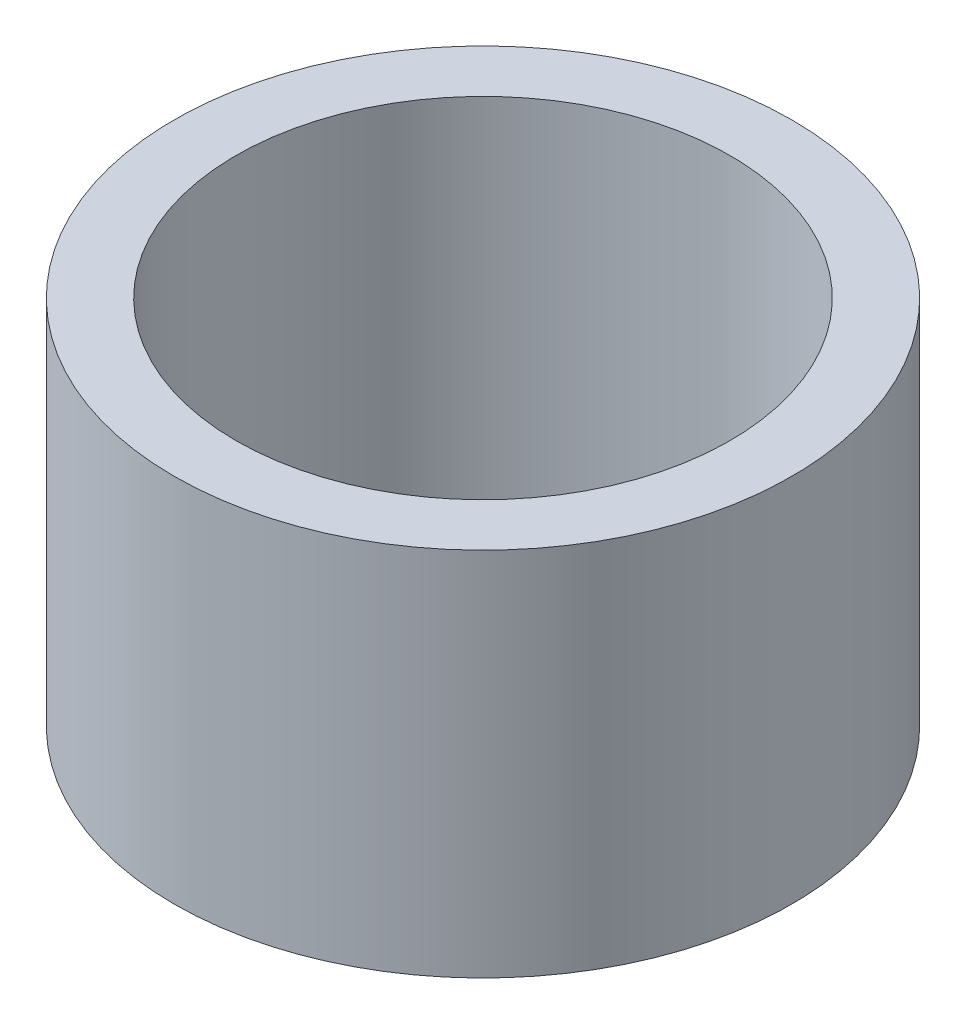
from build123d import *

# Parameters (mm, degrees)
SKETCH1_R           = 5
SKETCH1_R_2         = 4
BOSS_EXTRUDE1_DEPTH = 6


with BuildPart() as part:
    # Sketch1 → Boss-Extrude1 (new body)
    with BuildSketch(Plane(origin=(0, 0, 0), x_dir=(1, 0, 0), z_dir=(0, 1, 0))):
        with Locations(Location((0, 0, 0), (0, 0, 270))):
            Circle(SKETCH1_R)
        with Locations(Location((0, 0, 0), (0, 0, 270))):
            Circle(SKETCH1_R_2, mode=Mode.SUBTRACT)
    extrude(amount=BOSS_EXTRUDE1_DEPTH)


solid = part.part
